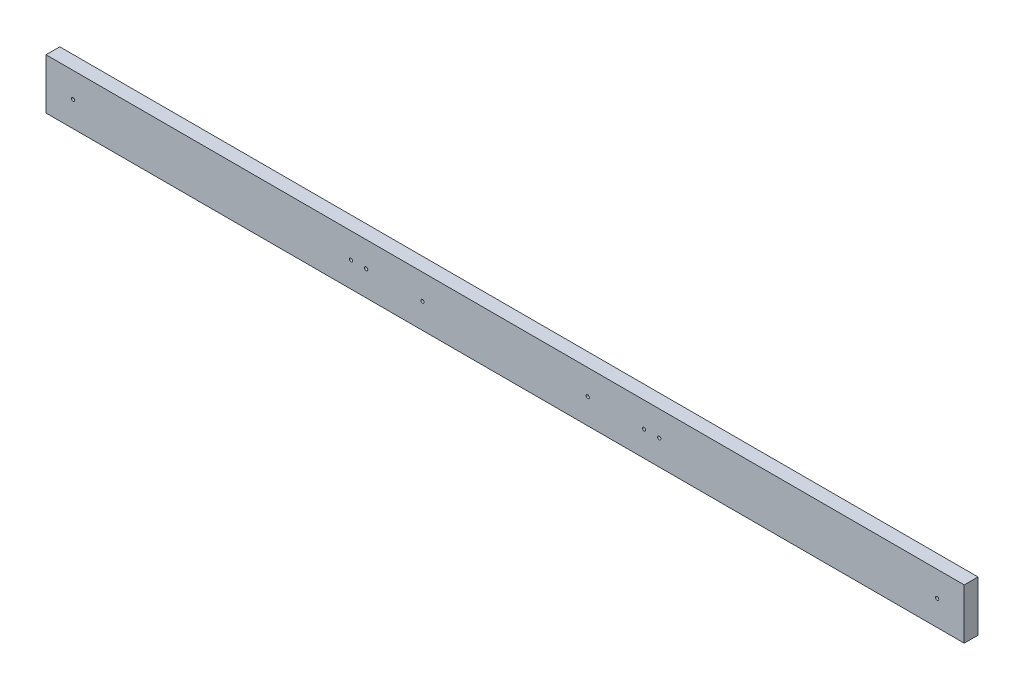
from build123d import *

# Parameters (mm, degrees)
SKETCH1_W                                    = 2540
SKETCH1_H                                    = 139.7
BOSS_EXTRUDE1_DEPTH                          = 38.1
SKETCH5_R                                    = 4.49961
HINGE_AND_MIDDLE_PANEL_BOLT_THRU_HOLES_DEPTH = 2545.124151845
SKETCH7_R                                    = 4.4996
CUT_EXTRUDE2_DEPTH                           = 2545.124151845


with BuildPart() as part:
    # Sketch1 → Boss-Extrude1 (new body)
    with BuildSketch(Plane.XY):
        with Locations((1270, -69.85)):
            Rectangle(SKETCH1_W, SKETCH1_H)
    extrude(amount=BOSS_EXTRUDE1_DEPTH)

    # Sketch5 → hinge and middle panel bolt thru holes (cut, through all)
    with BuildSketch(Plane.XY.offset(38.1)):
        with Locations((1654.36042, -69.85)):
            Circle(SKETCH5_R)
        with Locations((885.63958, -69.85)):
            Circle(SKETCH5_R)
        with Locations((1041.4, -69.85)):
            Circle(SKETCH5_R)
        with Locations((1498.6, -69.85)):
            Circle(SKETCH5_R)
    extrude(amount=-HINGE_AND_MIDDLE_PANEL_BOLT_THRU_HOLES_DEPTH, mode=Mode.SUBTRACT)

    # Sketch7 → Cut-Extrude2 (cut, through all)
    with BuildSketch(Plane.XY.offset(38.1)):
        with Locations((1696.36042, -69.85)):
            Circle(SKETCH7_R)
        with Locations((2465.08122, -69.85)):
            Circle(SKETCH7_R)
        with Locations((74.91878, -69.85)):
            Circle(SKETCH7_R)
        with Locations((843.63958, -69.85)):
            Circle(SKETCH7_R)
    extrude(amount=-CUT_EXTRUDE2_DEPTH, mode=Mode.SUBTRACT)


solid = part.part
